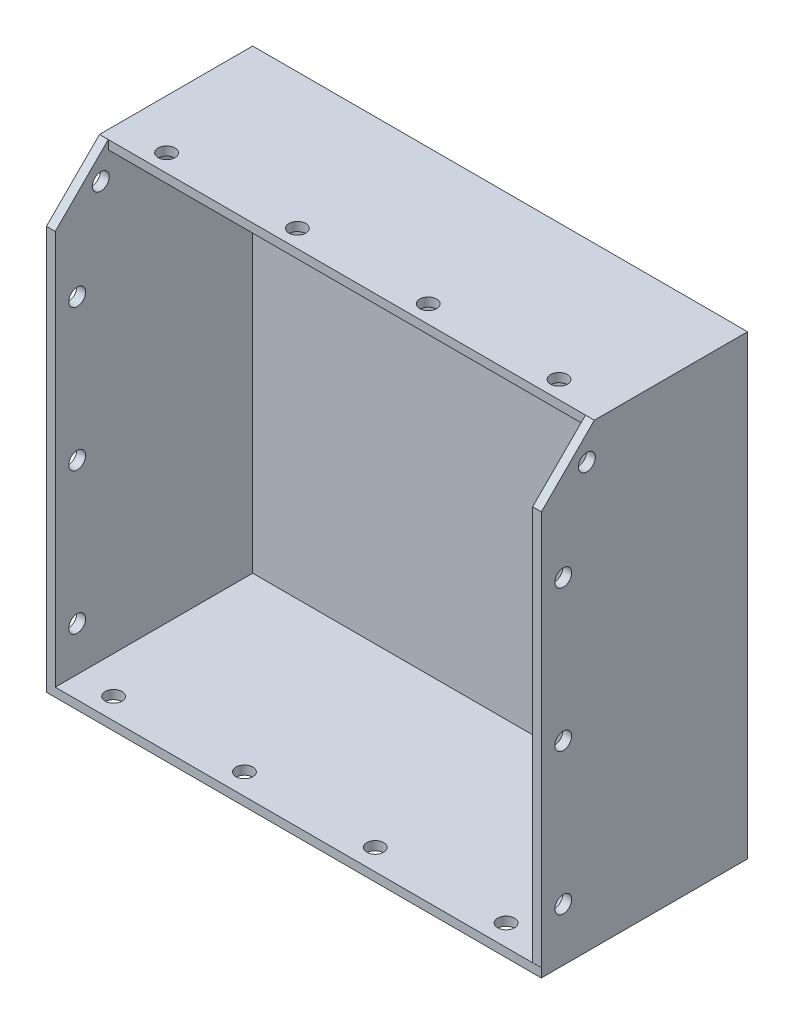
from build123d import *

# Parameters (mm, degrees)
SKETCH2_W                = 211.751333334
SKETCH2_H                = 164
BOSS_EXTRUDE1_DEPTH      = 74.083333333
CUT_EXTRUDE7_DEPTH       = 70.90833333
CUT_EXTRUDE9_REACH       = 240.853
CUT_EXTRUDE10_DEPTH      = 3.175
SKETCH14_W               = 205.401333334
SKETCH14_H               = 3.175
CUT_EXTRUDE11_DEPTH      = 3.175
CUT_EXTRUDE12_DEPTH      = 239.853443446
CUT_EXTRUDE12_DEPTH_BACK = 3.175
CUT_EXTRUDE14_REACH      = 210.792
SKETCH18_R               = 3.025
LPATTERN2_COUNT          = 4
LPATTERN2_PITCH          = 46.99
CUT_EXTRUDE15_REACH      = 210.792
SKETCH19_R               = 3.025
LPATTERN3_COUNT          = 4
LPATTERN3_PITCH          = 46.99
BOSS_EXTRUDE2_DEPTH      = 70.866
SKETCH25_W               = 3.175
SKETCH25_H               = 19.00766667
BOSS_EXTRUDE3_DEPTH      = 3.175
CUT_EXTRUDE18_REACH      = 211.317
CUT_EXTRUDE19_REACH      = 155.042
SKETCH16_R               = 3.025
CUT_EXTRUDE20_DEPTH      = 210.317467246
LPATTERN4_COUNT          = 3
LPATTERN4_PITCH          = 50.8
SKETCH20_R               = 3.025
CUT_EXTRUDE21_DEPTH      = 210.317467246


with BuildPart() as part:
    # Sketch2 → Boss-Extrude1 (new body)
    with BuildSketch(Plane.XY):
        Rectangle(SKETCH2_W, SKETCH2_H)
    extrude(amount=BOSS_EXTRUDE1_DEPTH)

    # Sketch9 → Cut-Extrude7 (cut)
    with BuildSketch(Plane.XY.offset(74.083333333)):
        Polygon((-102.700666667, 62.95), (-102.700666667, -47.748173381), (-102.700666667, -78.825), (-61.266487403, -78.825), (102.700666667, -78.825), (102.700666667, -21.962957065), (102.700666667, 78.825), (-87.76182231, 78.825), (-102.700666667, 78.825), align=None)
    extrude(amount=-CUT_EXTRUDE7_DEPTH, mode=Mode.SUBTRACT)

    # Sketch11 → Cut-Extrude9 (cut, up to next)
    with BuildSketch(Plane.ZY.offset(105.875666667), mode=Mode.PRIVATE) as cut_extrude9_sk1:
        Polygon((58.208333333, 78.825), (74.083333333, 62.95), (74.083333333, 82), (58.208333333, 82), (58.208333333, 79.62382388), align=None)
    cut_extrude9_tool1 = extrude(cut_extrude9_sk1.sketch, amount=-CUT_EXTRUDE9_REACH, mode=Mode.PRIVATE) & part.part
    add(cut_extrude9_tool1.solids().sort_by_distance((-105.875667, 75.49881, 68.035714))[0], mode=Mode.SUBTRACT)

    # Sketch13 → Cut-Extrude10 (cut)
    with BuildSketch(Plane.ZY.offset(105.875666667)):
        Polygon((58.208333333, 78.825), (55.033333333, 82), (58.208333333, 82), align=None)
    extrude(amount=-CUT_EXTRUDE10_DEPTH, mode=Mode.SUBTRACT)

    # Sketch14 → Cut-Extrude11 (cut)
    with BuildSketch(Plane.XY.offset(58.208333333)):
        with Locations((0, 80.4125)):
            Rectangle(SKETCH14_W, SKETCH14_H)
    extrude(amount=-CUT_EXTRUDE11_DEPTH, mode=Mode.SUBTRACT)

    # Sketch15 → Cut-Extrude12 (cut, two sides: drawn at the far end of the back side and taken through both)
    with BuildSketch(Plane(origin=(105.875666667, 0, 0), x_dir=(0, 0, -1), z_dir=(1, 0, 0)).offset(-CUT_EXTRUDE12_DEPTH_BACK)):
        Polygon((-58.208333333, 79.215720039), (-58.208333333, 78.825), (-55.033333333, 82), (-58.208333333, 82), align=None)
    extrude(amount=CUT_EXTRUDE12_DEPTH + CUT_EXTRUDE12_DEPTH_BACK, mode=Mode.SUBTRACT)

    # Sketch18 → Cut-Extrude14 (cut, up to next)
    with BuildSketch(Plane.XZ.offset(82), mode=Mode.PRIVATE) as cut_extrude14_sk1:
        with Locations(Location((-89.365666667, 66.463333333, 0), (0, 0, 270))):
            Circle(SKETCH18_R)
    cut_extrude14_tool1 = extrude(cut_extrude14_sk1.sketch, amount=-CUT_EXTRUDE14_REACH, mode=Mode.PRIVATE) & part.part
    cut_extrude14 = cut_extrude14_tool1.solids().sort_by_distance((-89.365667, -82, 66.463333))[0]
    add(cut_extrude14, mode=Mode.SUBTRACT)

    # LPattern2: Cut-Extrude14 ×4
    with Locations(*[(i * LPATTERN2_PITCH, 0, 0) for i in range(1, LPATTERN2_COUNT)]):
        add(cut_extrude14, mode=Mode.SUBTRACT)

    # Sketch19 → Cut-Extrude15 (cut, up to next)
    with BuildSketch(Plane(origin=(0, 82, 0), x_dir=(1, 0, 0), z_dir=(0, 1, 0)), mode=Mode.PRIVATE) as cut_extrude15_sk1:
        with Locations(Location((-88.125666667, -48.683333333, 0), (0, 0, 270))):
            Circle(SKETCH19_R)
    cut_extrude15_tool1 = extrude(cut_extrude15_sk1.sketch, amount=-CUT_EXTRUDE15_REACH, mode=Mode.PRIVATE) & part.part
    cut_extrude15 = cut_extrude15_tool1.solids().sort_by_distance((-88.125667, 82, 48.683333))[0]
    add(cut_extrude15, mode=Mode.SUBTRACT)

    # LPattern3: Cut-Extrude15 ×4
    with Locations(*[(i * LPATTERN3_PITCH, 0, 0) for i in range(1, LPATTERN3_COUNT)]):
        add(cut_extrude15, mode=Mode.SUBTRACT)

    # Sketch22 → Boss-Extrude2 (add)
    with BuildSketch(Plane.XY.offset(3.175000003)):
        Polygon((68.717333313, 46.40313661), (68.717333313, 78.825), (71.892333313, 78.825), (71.892333313, -78.825), (68.717333313, -78.825), align=None)
    extrude(amount=BOSS_EXTRUDE2_DEPTH)

    # Sketch25 → Boss-Extrude3 (add)
    with BuildSketch(Plane(origin=(0, 78.825, 0), x_dir=(1, 0, 0), z_dir=(0, 1, 0))):
        with Locations((70.304833313, -64.537166668)):
            Rectangle(SKETCH25_W, SKETCH25_H)
    extrude(amount=BOSS_EXTRUDE3_DEPTH)

    # Sketch26 → Cut-Extrude18 (cut, up to next)
    with BuildSketch(Plane(origin=(71.892333313, 0, 0), x_dir=(0, 0, -1), z_dir=(1, 0, 0)), mode=Mode.PRIVATE) as cut_extrude18_sk1:
        Polygon((-74.083333333, 62.95), (-55.033333333, 82), (-74.041000003, 82), align=None)
    cut_extrude18_tool1 = extrude(cut_extrude18_sk1.sketch, amount=-CUT_EXTRUDE18_REACH, mode=Mode.PRIVATE) & part.part
    add(cut_extrude18_tool1.solids().sort_by_distance((71.892333, 75.65, 67.719222))[0], mode=Mode.SUBTRACT)

    # Sketch27 → Cut-Extrude19 (cut, up to next)
    with BuildSketch(Plane.XY.offset(74.083333333), mode=Mode.PRIVATE) as cut_extrude19_sk1:
        Polygon((71.892333313, -78.825), (71.892333313, -82), (105.875666667, -82), (105.875666667, 82), (71.892333313, 82), align=None)
    cut_extrude19_tool1 = extrude(cut_extrude19_sk1.sketch, amount=-CUT_EXTRUDE19_REACH, mode=Mode.PRIVATE) & part.part
    add(cut_extrude19_tool1.solids().sort_by_distance((88.884, 0, 74.083333))[0], mode=Mode.SUBTRACT)

    # Sketch16 → Cut-Extrude20 (cut, through all)
    with BuildSketch(Plane.ZY.offset(105.875666667)):
        with Locations((66.209333333, -62.95)):
            Circle(SKETCH16_R)
    cut_extrude20 = extrude(amount=-CUT_EXTRUDE20_DEPTH, mode=Mode.SUBTRACT)

    # LPattern4: Cut-Extrude20 ×3
    with Locations(*[(0, i * LPATTERN4_PITCH, 0) for i in range(1, LPATTERN4_COUNT)]):
        add(cut_extrude20, mode=Mode.SUBTRACT)

    # Sketch20 → Cut-Extrude21 (cut, through all)
    with BuildSketch(Plane.ZY.offset(105.875666667)):
        with Locations((57.72741017, 70.325667043)):
            Circle(SKETCH20_R)
    extrude(amount=-CUT_EXTRUDE21_DEPTH, mode=Mode.SUBTRACT)


solid = part.part
